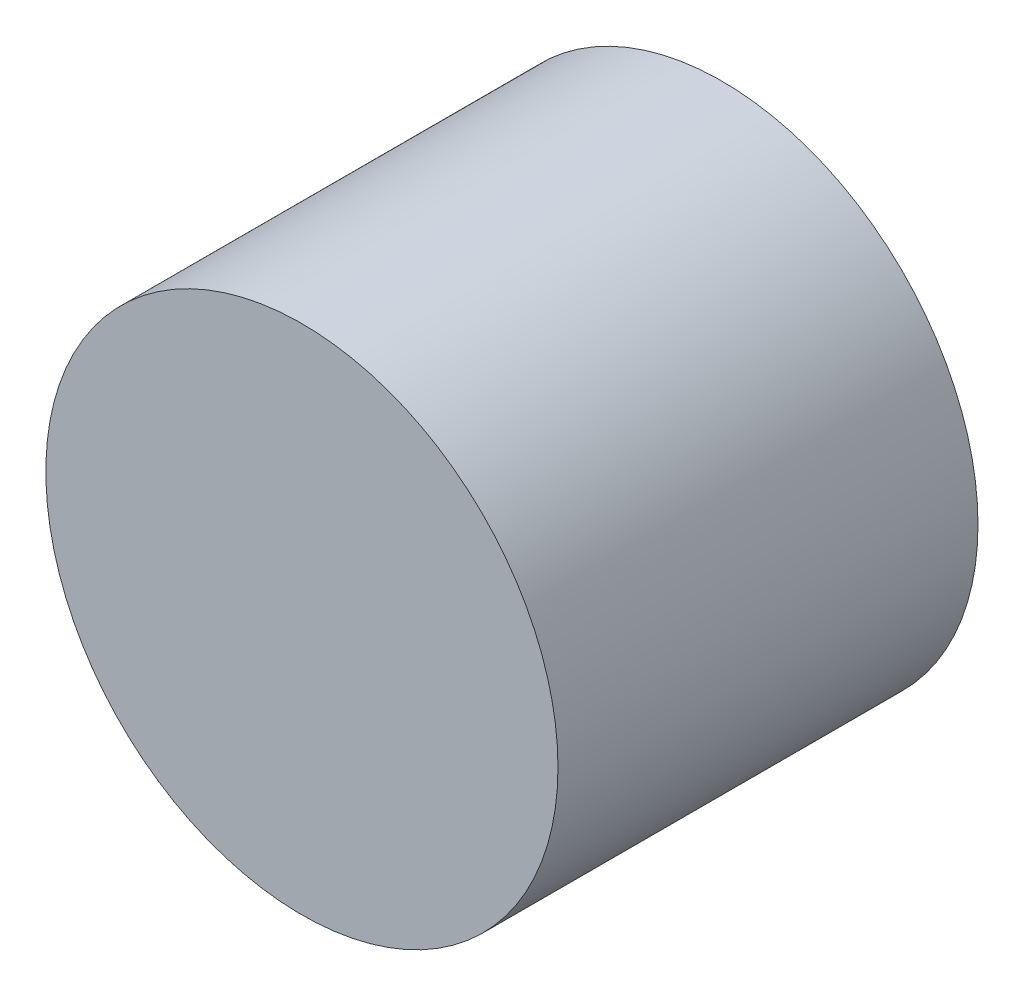
from build123d import *

# Parameters (mm, degrees)
SKETCH1_R      = 9.755
ENVELOPE_DEPTH = 16


with BuildPart() as part:
    # Sketch1 → Envelope (new body)
    with BuildSketch(Plane.XY):
        Circle(SKETCH1_R)
    extrude(amount=ENVELOPE_DEPTH)


solid = part.part
